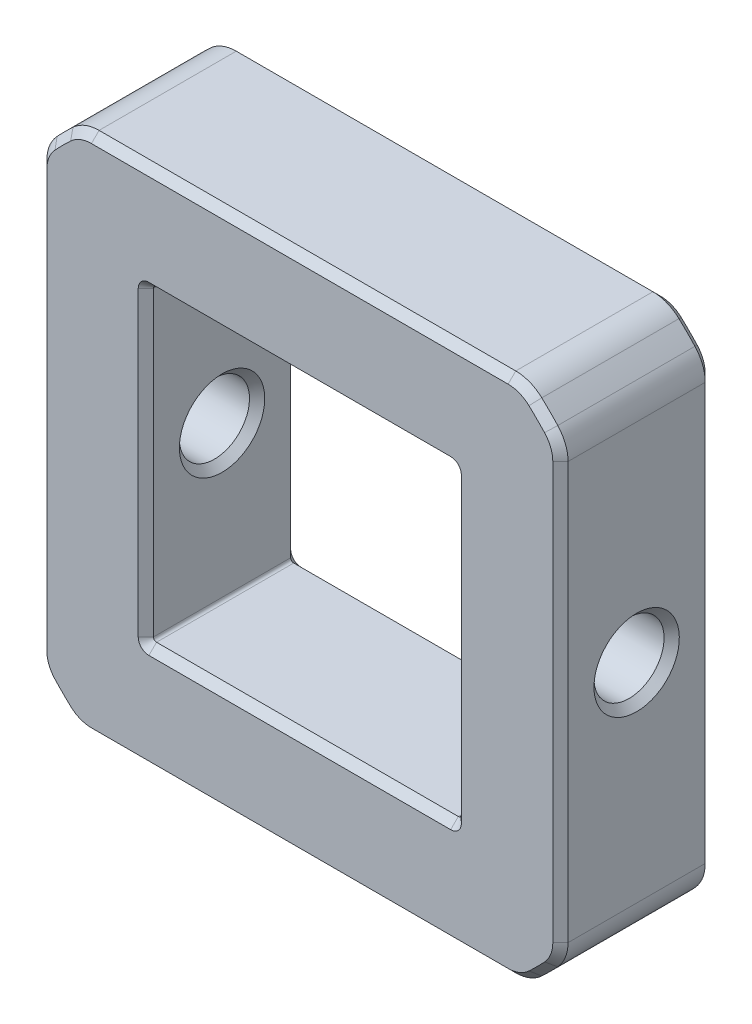
from build123d import *

# Parameters (mm, degrees)
SKIZZE1_W                       = 20.2
SKIZZE1_H                       = 20.2
AUFSATZ_LINEAR_AUSTRAGEN1_DEPTH = 10
VERRUNDUNG1_R                   = 0.2
VERRUNDUNG2_R                   = 2.5
SKIZZE2_R                       = 2.3
SCHNITT_LINEAR_AUSTRAGEN1_DEPTH = 40.522778242
FASE2_SIZE                      = 0.5


with BuildPart() as part:
    # Skizze1 → Aufsatz-Linear austragen1 (new body)
    with BuildSketch(Plane.XY):
        with BuildLine():
            Line((14.623269128, 17.1), (-14.623269128, 17.1))
            ThreePointArc((-14.623269128, 17.1), (-15.909902577, 15.909902577), (-17.1, 14.623269128))
            Line((-17.1, 14.623269128), (-17.1, -14.623269128))
            ThreePointArc((-17.1, -14.623269128), (-15.909902577, -15.909902577), (-14.623269128, -17.1))
            Line((-14.623269128, -17.1), (14.623269128, -17.1))
            ThreePointArc((14.623269128, -17.1), (15.909902577, -15.909902577), (17.1, -14.623269128))
            Line((17.1, -14.623269128), (17.1, 14.623269128))
            ThreePointArc((17.1, 14.623269128), (15.909902577, 15.909902577), (14.623269128, 17.1))
        make_face()
        Rectangle(SKIZZE1_W, SKIZZE1_H, mode=Mode.SUBTRACT)
    extrude(amount=AUFSATZ_LINEAR_AUSTRAGEN1_DEPTH)

    # Verrundung1
    verrundung1_edges = [part.edges().sort_by_distance(p)[0] for p in [
        (10.1, -10.1, 5),
        (10.1, 10.1, 5),
        (-10.1, 10.1, 5),
        (-10.1, -10.1, 5),
    ]]
    fillet(verrundung1_edges, radius=VERRUNDUNG1_R)

    # Verrundung2
    verrundung2_edges = [part.edges().sort_by_distance(p)[0] for p in [
        (17.1, 14.623269128, 5),
        (17.1, -14.623269128, 5),
        (14.623269128, -17.1, 5),
        (-14.623269128, -17.1, 5),
        (-17.1, -14.623269128, 5),
        (-17.1, 14.623269128, 5),
        (-14.623269128, 17.1, 5),
        (14.623269128, 17.1, 5),
    ]]
    fillet(verrundung2_edges, radius=VERRUNDUNG2_R)

    # Skizze2 → Schnitt-Linear austragen1 (cut, through all)
    with BuildSketch(Plane(origin=(17.1, 0, 0), x_dir=(0, 0, -1), z_dir=(1, 0, 0))):
        with Locations(Location((-5, 0, 0), (0, 0, 90))):
            Circle(SKIZZE2_R)
    extrude(amount=-SCHNITT_LINEAR_AUSTRAGEN1_DEPTH, mode=Mode.SUBTRACT)

    # Fase2
    fase2_edges = [part.edges().sort_by_distance(p)[0] for p in [
        (-10.1, -2.3, 5),
        (10.1, -2.3, 5),
        (-17.1, -2.3, 5),
        (17.1, -2.3, 5),
        (0, -10.1, 0),
        (0, -10.1, 10),
        (10.1, 0, 0),
        (10.1, 0, 10),
        (-10.1, 0, 0),
        (-10.1, 0, 10),
        (0, 10.1, 0),
        (0, 10.1, 10),
        (10.041421356, -10.041421356, 0),
        (10.041421356, -10.041421356, 10),
        (-10.041421356, -10.041421356, 0),
        (-10.041421356, -10.041421356, 10),
        (-10.041421356, 10.041421356, 0),
        (-10.041421356, 10.041421356, 10),
        (10.041421356, 10.041421356, 0),
        (10.041421356, 10.041421356, 10),
        (0, 17.1, 0),
        (0, 17.1, 10),
        (15.909902577, 15.909902577, 0),
        (17.1, 0, 0),
        (15.909902577, -15.909902577, 0),
        (0, -17.1, 0),
        (-15.909902577, -15.909902577, 0),
        (-17.1, 0, 0),
        (-15.909902577, 15.909902577, 0),
        (-14.587501553, 16.925134405, 0),
        (-16.925134405, 14.587501553, 0),
        (-16.925134405, -14.587501553, 0),
        (-14.587501553, -16.925134405, 0),
        (14.587501553, -16.925134405, 0),
        (16.925134405, -14.587501553, 0),
        (16.925134405, 14.587501553, 0),
        (14.587501553, 16.925134405, 0),
        (15.909902577, 15.909902577, 10),
        (-15.909902577, 15.909902577, 10),
        (-17.1, 0, 10),
        (-15.909902577, -15.909902577, 10),
        (0, -17.1, 10),
        (15.909902577, -15.909902577, 10),
        (17.1, 0, 10),
        (-14.587501553, 16.925134405, 10),
        (-16.925134405, 14.587501553, 10),
        (-16.925134405, -14.587501553, 10),
        (-14.587501553, -16.925134405, 10),
        (14.587501553, -16.925134405, 10),
        (16.925134405, -14.587501553, 10),
        (16.925134405, 14.587501553, 10),
        (14.587501553, 16.925134405, 10),
    ]]
    chamfer(fase2_edges, length=FASE2_SIZE)


solid = part.part
